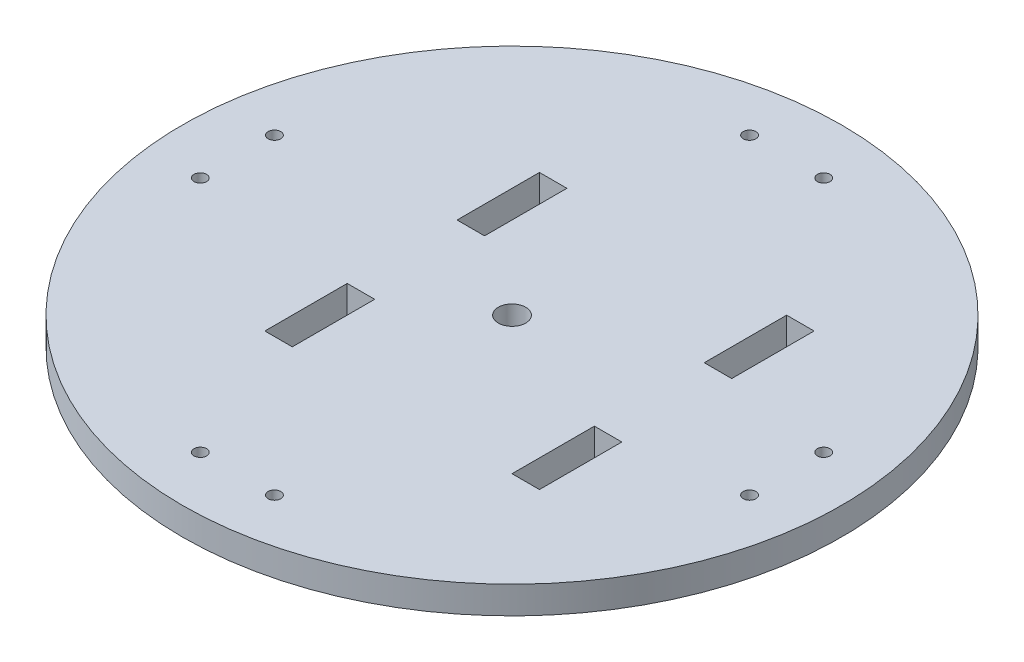
from build123d import *

# Parameters (mm, degrees)
SKETCH1_R           = 60
SKETCH1_R_2         = 2.5
BOSS_EXTRUDE1_DEPTH = 5
SKETCH4_R           = 1.15
CUT_EXTRUDE1_DEPTH  = 5
SKETCH5_W           = 5
SKETCH5_H           = 15
CUT_EXTRUDE2_DEPTH  = 5
SKETCH6_W           = 5
SKETCH6_H           = 15
CUT_EXTRUDE3_DEPTH  = 5


with BuildPart() as part:
    # Sketch1 → Boss-Extrude1 (new body)
    with BuildSketch(Plane(origin=(0, 0, 0), x_dir=(1, 0, 0), z_dir=(0, 1, 0))):
        with Locations(Location((0, 0, 0), (0, 0, 270))):
            Circle(SKETCH1_R)
        with Locations(Location((0, 0, 0), (0, 0, 270))):
            Circle(SKETCH1_R_2, mode=Mode.SUBTRACT)
    extrude(amount=BOSS_EXTRUDE1_DEPTH)

    # Sketch4 → Cut-Extrude1 (cut)
    with BuildSketch(Plane(origin=(0, 5, 0), x_dir=(1, 0, 0), z_dir=(0, 1, 0))):
        with Locations(Location((-6.75, 50, 0), (0, 0, 270))):
            Circle(SKETCH4_R)
        with Locations(Location((50, 6.75, 0), (0, 0, 270))):
            Circle(SKETCH4_R)
        with Locations(Location((6.75, -50, 0), (0, 0, 270))):
            Circle(SKETCH4_R)
        with Locations(Location((-50, -6.75, 0), (0, 0, 270))):
            Circle(SKETCH4_R)
        with Locations(Location((6.75, 50, 0), (0, 0, 90))):
            Circle(SKETCH4_R)
        with Locations(Location((50, -6.75, 0), (0, 0, 90))):
            Circle(SKETCH4_R)
        with Locations(Location((-6.75, -50, 0), (0, 0, 90))):
            Circle(SKETCH4_R)
        with Locations(Location((-50, 6.75, 0), (0, 0, 90))):
            Circle(SKETCH4_R)
    extrude(amount=-CUT_EXTRUDE1_DEPTH, mode=Mode.SUBTRACT)

    # Sketch5 → Cut-Extrude2 (cut)
    with BuildSketch(Plane(origin=(0, 5, 0), x_dir=(1, 0, 0), z_dir=(0, 1, 0))):
        with Locations((-17.5, 17.5)):
            Rectangle(SKETCH5_W, SKETCH5_H)
        with Locations((-17.5, -17.5)):
            Rectangle(SKETCH5_W, SKETCH5_H)
    extrude(amount=-CUT_EXTRUDE2_DEPTH, mode=Mode.SUBTRACT)

    # Sketch6 → Cut-Extrude3 (cut)
    with BuildSketch(Plane(origin=(0, 5, 0), x_dir=(1, 0, 0), z_dir=(0, 1, 0))):
        with Locations((27.5, 17.5)):
            Rectangle(SKETCH6_W, SKETCH6_H)
        with Locations((27.5, -17.5)):
            Rectangle(SKETCH6_W, SKETCH6_H)
    extrude(amount=-CUT_EXTRUDE3_DEPTH, mode=Mode.SUBTRACT)


solid = part.part
